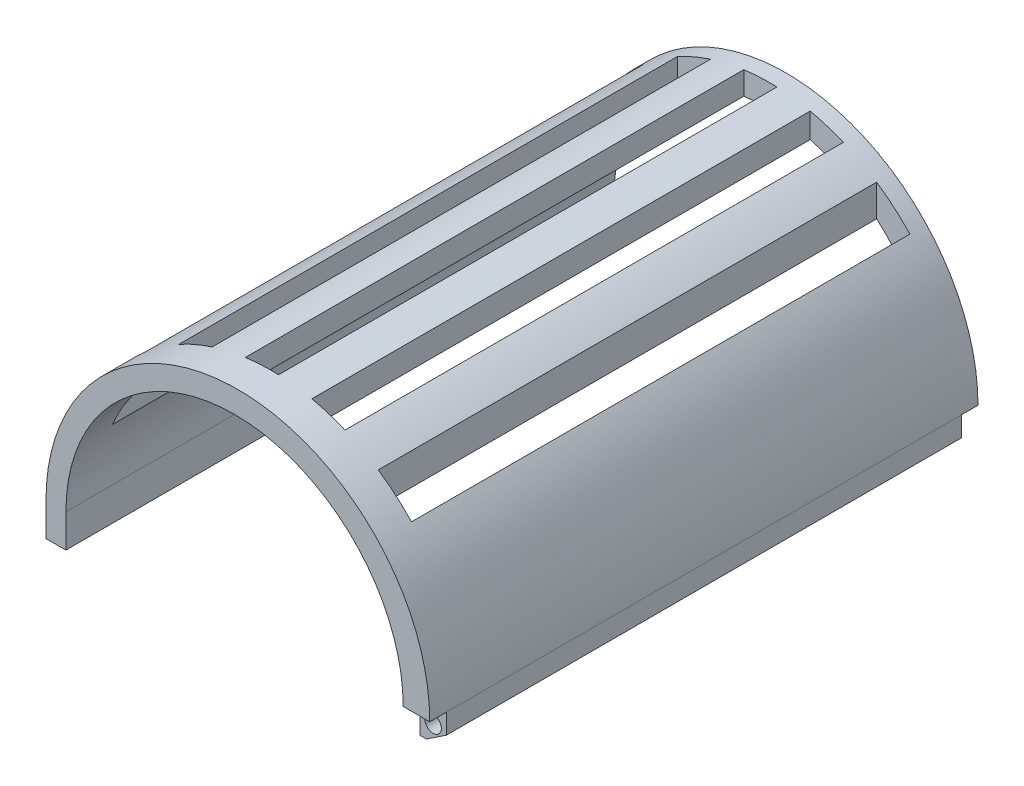
from build123d import *

# Parameters (mm, degrees)
EXTRUDE_1_DEPTH     = 165
SKETCH_2_W          = 10
SKETCH_2_H          = 150
CUT_EXTRUDE_1_DEPTH = 185.106287236
SKETCH_3_W          = 8
SKETCH_3_H          = 155
EXTRUDE_2_DEPTH     = 10
SKETCH_4_R          = 2.5
CUT_EXTRUDE_2_DEPTH = 180.638873855
SKETCH_5_W          = 20
SKETCH_5_H          = 3
EXTRUDE_3_DEPTH     = 10
CUT_EXTRUDE_3_DEPTH = 184.098675582


with BuildPart() as part:
    # 草圖1 → 填料-伸長1 (new body)
    with BuildSketch(Plane.XY):
        with BuildLine():
            Line((-57.75, 0), (-57.75, -10))
            Line((-57.75, -10), (-51.75, -10))
            Line((-51.75, -10), (-51.75, 0))
            ThreePointArc((-51.75, 0), (-1, 50.75), (49.75, 0))
            Line((49.75, 0), (57.75, 0))
            ThreePointArc((57.75, 0), (0, 57.75), (-57.75, 0))
        make_face()
    extrude(amount=EXTRUDE_1_DEPTH)

    # 草圖2 → 除料-伸長1 (cut, through all)
    with BuildSketch(Plane(origin=(0, 0, 0), x_dir=(1, 0, 0), z_dir=(0, 1, 0))):
        with Locations((-42.75, -80)):
            Rectangle(SKETCH_2_W, SKETCH_2_H)
        with Locations((-22.75, -80)):
            Rectangle(SKETCH_2_W, SKETCH_2_H)
        with Locations((-2.75, -80)):
            Rectangle(SKETCH_2_W, SKETCH_2_H)
        with Locations((17.25, -80)):
            Rectangle(SKETCH_2_W, SKETCH_2_H)
        with Locations((37.25, -80)):
            Rectangle(SKETCH_2_W, SKETCH_2_H)
    extrude(amount=CUT_EXTRUDE_1_DEPTH, mode=Mode.SUBTRACT)

    # 草圖3 → 填料-伸長2 (add)
    with BuildSketch(Plane.XZ):
        with Locations((53.75, 82.5)):
            Rectangle(SKETCH_3_W, SKETCH_3_H)
    extrude(amount=EXTRUDE_2_DEPTH)

    # 草圖4 → 除料-伸長2 (cut, through all)
    with BuildSketch(Plane.XY.offset(160)):
        with Locations((53.75, -5)):
            Circle(SKETCH_4_R)
    extrude(amount=-CUT_EXTRUDE_2_DEPTH, mode=Mode.SUBTRACT)

    # 草圖5 → 填料-伸長3 (add)
    with BuildSketch(Plane.ZY.offset(57.75)):
        with Locations((82.5, -8.5)):
            Rectangle(SKETCH_5_W, SKETCH_5_H)
    extrude(amount=EXTRUDE_3_DEPTH)

    # 草圖6 → 除料-伸長3 (cut, through all)
    with BuildSketch(Plane.XY.offset(160)):
        Polygon((57.75, -10), (57.75, -6), (51.75, -10), align=None)
    extrude(amount=-CUT_EXTRUDE_3_DEPTH, mode=Mode.SUBTRACT)


solid = part.part
